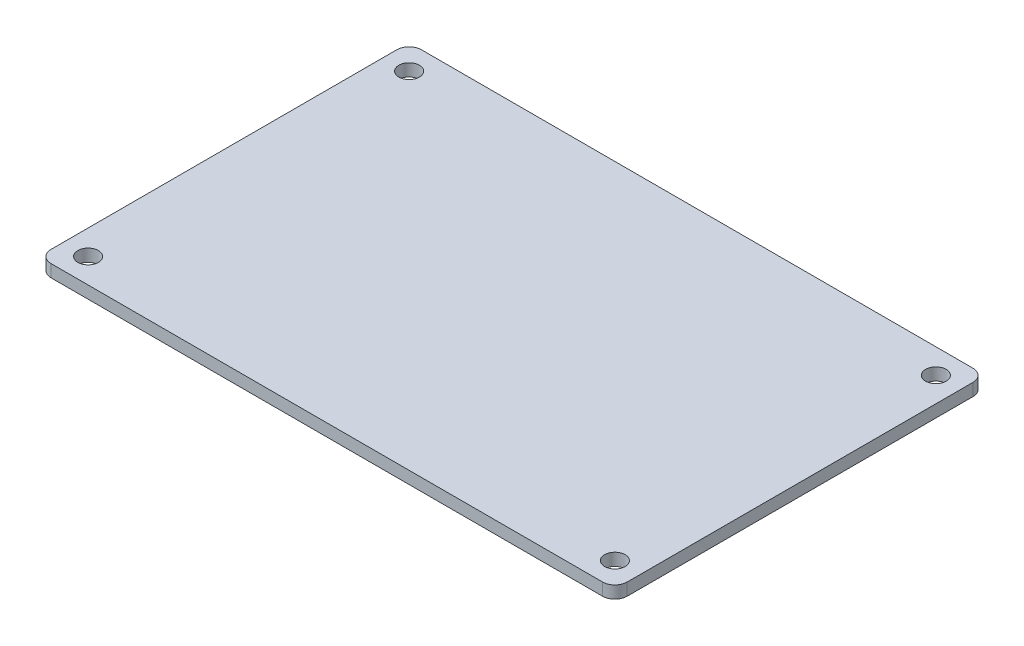
from build123d import *

# Parameters (mm, degrees)
SKETCH_1_R        = 6
SKETCH_1_R_2      = 3
EXTRUDE_1_DEPTH   = 9
EXTRUDE_1_2_DEPTH = 9
EXTRUDE_1_3_DEPTH = 9
EXTRUDE_1_4_DEPTH = 9
SKETCH_2_W        = 140
SKETCH_2_H        = 90
SKETCH_2_R        = 2.5
EXTRUDE_2_DEPTH   = 3
FILLET_1_R        = 3


with BuildPart() as part:
    # Эскиз1 → Бобышка-Вытянуть1 (new body)
    with BuildSketch(Plane(origin=(0, 0, 0), x_dir=(1, 0, 0), z_dir=(0, 1, 0))):
        with Locations(Location((-34.925000029, 23.728220461, 0), (0, 0, 270))):
            Circle(SKETCH_1_R)
        with Locations(Location((-34.925000029, 23.728220461, 0), (0, 0, 270))):
            Circle(SKETCH_1_R_2, mode=Mode.SUBTRACT)
    extrude(amount=-EXTRUDE_1_DEPTH)



with BuildPart() as body_2:
    # Эскиз1 → Extrude 1 2 (new body)
    with BuildSketch(Plane(origin=(0, 0, 0), x_dir=(1, 0, 0), z_dir=(0, 1, 0))):
        with Locations(Location((40.004999984, 23.728220453, 0), (0, 0, 270))):
            Circle(SKETCH_1_R)
        with Locations(Location((40.004999984, 23.728220453, 0), (0, 0, 270))):
            Circle(SKETCH_1_R_2, mode=Mode.SUBTRACT)
    extrude(amount=-EXTRUDE_1_2_DEPTH)


with BuildPart() as body_3:
    # Эскиз1 → Extrude 1 3 (new body)
    with BuildSketch(Plane(origin=(0, 0, 0), x_dir=(1, 0, 0), z_dir=(0, 1, 0))):
        with Locations(Location((41.275000034, -24.53177948, 0), (0, 0, 270))):
            Circle(SKETCH_1_R)
        with Locations(Location((41.275000034, -24.53177948, 0), (0, 0, 270))):
            Circle(SKETCH_1_R_2, mode=Mode.SUBTRACT)
    extrude(amount=-EXTRUDE_1_3_DEPTH)


with BuildPart() as body_4:
    # Эскиз1 → Extrude 1 4 (new body)
    with BuildSketch(Plane(origin=(0, 0, 0), x_dir=(1, 0, 0), z_dir=(0, 1, 0))):
        with Locations(Location((-41.275000034, -24.531779532, 0), (0, 0, 270))):
            Circle(SKETCH_1_R)
        with Locations(Location((-41.275000034, -24.531779532, 0), (0, 0, 270))):
            Circle(SKETCH_1_R_2, mode=Mode.SUBTRACT)
    extrude(amount=-EXTRUDE_1_4_DEPTH)


with BuildPart() as part_1:
    add(part.part)

    add(body_2.part)  # Бобышка-Вытянуть2 merges body 2

    add(body_3.part)  # Бобышка-Вытянуть2 merges body 3

    add(body_4.part)  # Бобышка-Вытянуть2 merges body 4
    # Эскиз2 → Бобышка-Вытянуть2 (add)
    with BuildSketch(Plane(origin=(0, 0, 0), x_dir=(1, 0, 0), z_dir=(0, 1, 0))):
        with Locations((-0.274084252, -0.781638626)):
            Rectangle(SKETCH_2_W, SKETCH_2_H)
        with Locations(Location((-64.274084252, 38.218361374, 0), (0, 0, 270))):
            Circle(SKETCH_2_R, mode=Mode.SUBTRACT)
        with Locations(Location((63.725915748, 38.218361374, 0), (0, 0, 90))):
            Circle(SKETCH_2_R, mode=Mode.SUBTRACT)
        with Locations(Location((63.725915748, -39.781638626, 0), (0, 0, 270))):
            Circle(SKETCH_2_R, mode=Mode.SUBTRACT)
        with Locations(Location((-64.274084252, -39.781638626, 0), (0, 0, 90))):
            Circle(SKETCH_2_R, mode=Mode.SUBTRACT)
    extrude(amount=-EXTRUDE_2_DEPTH)

    # Скругление1
    fillet_1_edges = [part_1.edges().sort_by_distance(p)[0] for p in [
        (69.725915748, -1.5, -44.218361374),
        (69.725915748, -1.5, 45.781638626),
        (-70.274084252, -1.5, 45.781638626),
        (-70.274084252, -1.5, -44.218361374),
    ]]
    fillet(fillet_1_edges, radius=FILLET_1_R)


solid = part_1.part
